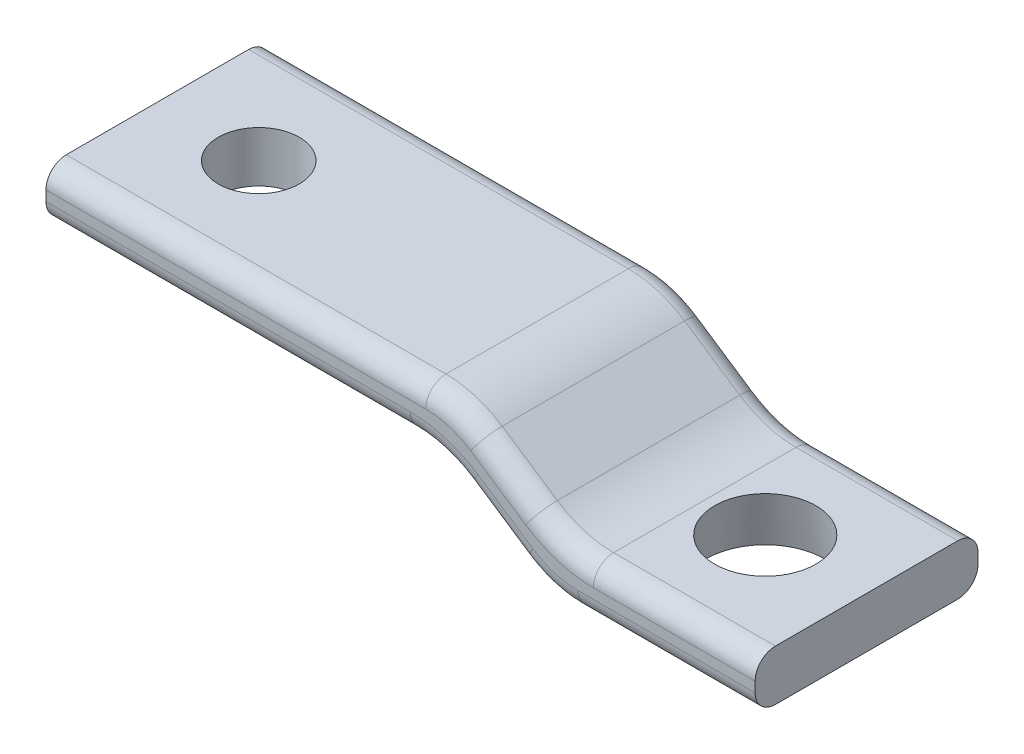
from build123d import *

# Parameters (mm, degrees)
EXTRUSION1_DEPTH        = 11
CONG_2_R                = 2
ESQUISSE2_R             = 4
ENL_V_MAT_EXTRU_1_DEPTH = 72.867934435


with BuildPart() as part:
    # Esquisse1 → Extrusion1 (new, symmetric)
    with BuildSketch(Plane.XY):
        with BuildLine():
            Line((0, 0), (37.484227511, 0))
            ThreePointArc((37.484227511, 0), (40.385390018, -0.430085888), (43.037002714, -1.683348779))
            Line((43.037002714, -1.683348779), (48.478769775, -5.316651221))
            ThreePointArc((48.478769775, -5.316651221), (51.130382471, -6.569914112), (54.031544979, -7))
            Line((54.031544979, -7), (70, -7))
            Line((70, -7), (70, -12))
            Line((70, -12), (52.515772489, -12))
            ThreePointArc((52.515772489, -12), (49.614609982, -11.569914112), (46.962997286, -10.316651221))
            Line((46.962997286, -10.316651221), (41.521230225, -6.683348779))
            ThreePointArc((41.521230225, -6.683348779), (38.869617529, -5.430085888), (35.968455021, -5))
            Line((35.968455021, -5), (0, -5))
            Line((0, -5), (0, 0))
        make_face()
    extrude(amount=EXTRUSION1_DEPTH, both=True)

    # Congé2
    cong_2_edges = [part.edges().sort_by_distance(p)[0] for p in [
        (38.869617529, -5.430085888, 11),
        (40.385390018, -0.430085888, -11),
        (45.757886245, -3.5, -11),
        (51.130382471, -6.569914112, -11),
        (62.015772489, -7, -11),
        (61.257886245, -12, -11),
        (49.614609982, -11.569914112, -11),
        (44.242113755, -8.5, -11),
        (44.242113755, -8.5, 11),
        (38.869617529, -5.430085888, -11),
        (17.984227511, -5, -11),
        (49.614609982, -11.569914112, 11),
        (61.257886245, -12, 11),
        (62.015772489, -7, 11),
        (51.130382471, -6.569914112, 11),
        (45.757886245, -3.5, 11),
        (40.385390018, -0.430085888, 11),
        (18.742113755, 0, 11),
        (17.984227511, -5, 11),
        (18.742113755, 0, -11),
    ]]
    fillet(cong_2_edges, radius=CONG_2_R)

    # Esquisse2 → Enlèv. mat.-Extru.1 (cut, through all)
    with BuildSketch(Plane(origin=(0, 0, 0), x_dir=(-1, 0, 0), z_dir=(0, 1, 0))):
        with Locations(Location((-10, 0, 0), (0, 0, 90))):
            Circle(ESQUISSE2_R)
    extrude(amount=-ENL_V_MAT_EXTRU_1_DEPTH, mode=Mode.SUBTRACT)

    # Esquisse3 → Enlèvement de matière-Révolution1 (revolve, cut)
    with BuildSketch(Plane.XY, mode=Mode.PRIVATE) as enl_vement_de_mati_re_r_volution1_sk:
        Polygon((65, -7), (65.881634904, -12), (60, -12), (60, -7), align=None)
    revolve(enl_vement_de_mati_re_r_volution1_sk.sketch.rotate(Axis((60, 1.983898021, 0), (0, -1, 0)), 90), axis=Axis((60, 1.983898021, 0), (0, -1, 0)), mode=Mode.SUBTRACT)


solid = part.part
